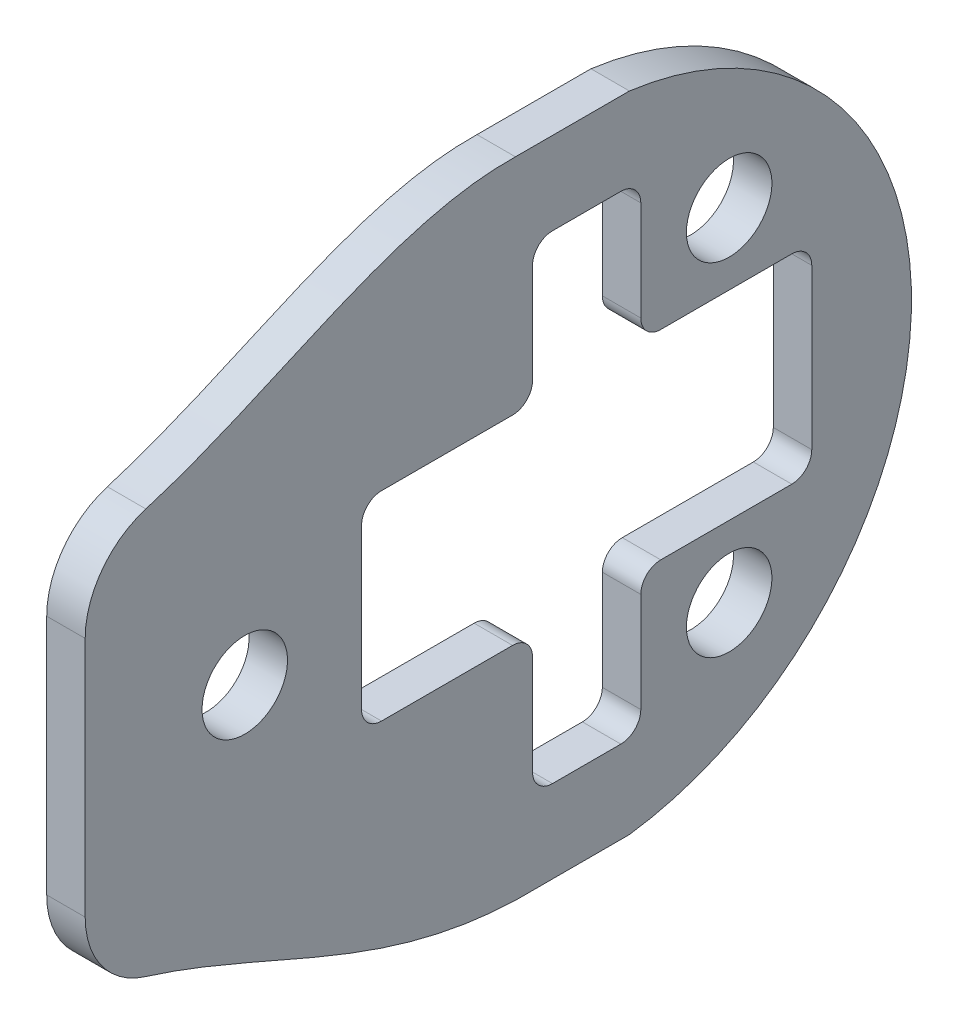
from build123d import *

# Parameters (mm, degrees)
SCHIZZO1_R                   = 1.5
ESTRUSIONE_ESTRUSIONE1_DEPTH = 1.35
RACCORDO2_R                  = 3
RACCORDO3_R                  = 3
RACCORDO4_R                  = 0.7


with BuildPart() as part:
    # Schizzo1 → Estrusione-Estrusione1 (new body)
    with BuildSketch(Plane(origin=(0, 0, 0), x_dir=(0, 0, -1), z_dir=(1, 0, 0))):
        with BuildLine():
            add(Edge.make_bspline(
                [(-7.501010101, -10.3), (-10.845030199, -9.13986581), (-13.865102381, -7.304364218), (-17.601010101, -6.594005849)],
                knots=[0.271280726, 0.271280726, 0.271280726, 0.271280726, 0.852483684, 0.852483684, 0.852483684, 0.852483684], degree=3))
            add(Edge.make_bspline(
                [(-2.501010101, -11.3), (-4.308742426, -11.235865063), (-5.940164296, -10.841501107), (-7.501010101, -10.3)],
                knots=[0, 0, 0, 0, 0.271280726, 0.271280726, 0.271280726, 0.271280726], degree=3))
            Line((-2.501010101, -11.3), (1.498989899, -11.3))
            ThreePointArc((1.498989899, -11.3), (11.398989899, 0), (1.498989899, 11.3))
            Line((1.498989899, 11.3), (-2.501010101, 11.3))
            add(Edge.make_bspline(
                [(-2.501010101, 11.3), (-4.209338931, 11.338090952), (-5.850739142, 10.914740779), (-7.501010101, 10.3)],
                knots=[0, 0, 0, 0, 0.293888871, 0.293888871, 0.293888871, 0.293888871], degree=3))
            add(Edge.make_bspline(
                [(-7.501010101, 10.3), (-10.658273676, 9.123890914), (-13.848006436, 7.247243694), (-17.601010101, 6.561146452)],
                knots=[0.293888871, 0.293888871, 0.293888871, 0.293888871, 0.856150858, 0.856150858, 0.856150858, 0.856150858], degree=3))
            Line((-17.601010101, 6.561146452), (-17.601010101, 0))
            Line((-17.601010101, 0), (-17.601010101, -6.594005849))
        make_face()
        with Locations(Location((5, -6, 0), (0, 0, 180))):
            Circle(SCHIZZO1_R, mode=Mode.SUBTRACT)
        with BuildLine():
            ThreePointArc((-10.5, 0), (-12, -1.5), (-13.5, 0))
            ThreePointArc((-13.5, 0), (-12, 1.5), (-10.5, 0))
        make_face(mode=Mode.SUBTRACT)
        Polygon((-7.9, -3.5), (-7.9, 0), (-7.9, 3.5), (-1.901010101, 3.5), (-1.901010101, 8.4), (1.898989899, 8.4), (1.898989899, 3.5), (7.898989899, 3.5), (7.898989899, -3.5), (1.898989899, -3.5), (1.898989899, -8.4), (-1.901010101, -8.4), (-1.901010101, -3.5), align=None, mode=Mode.SUBTRACT)
        with Locations(Location((5, 6, 0), (0, 0, 180))):
            Circle(SCHIZZO1_R, mode=Mode.SUBTRACT)
    extrude(amount=ESTRUSIONE_ESTRUSIONE1_DEPTH)

    # Raccordo2
    raccordo2_edges = [part.edges().sort_by_distance(p)[0] for p in [
        (0.675, -6.594005849, 17.601010101),
    ]]
    fillet(raccordo2_edges, radius=RACCORDO2_R)

    # Raccordo3
    raccordo3_edges = [part.edges().sort_by_distance(p)[0] for p in [
        (0.675, 6.561146452, 17.601010101),
    ]]
    fillet(raccordo3_edges, radius=RACCORDO3_R)

    # Raccordo4
    raccordo4_edges = [part.edges().sort_by_distance(p)[0] for p in [
        (0.675, -3.5, 1.901010101),
        (0.675, -8.4, 1.901010101),
        (0.675, -8.4, -1.898989899),
        (0.675, -3.5, -1.898989899),
        (0.675, -3.5, -7.898989899),
        (0.675, 3.5, -7.898989899),
        (0.675, 3.5, -1.898989899),
        (0.675, 8.4, -1.898989899),
        (0.675, 8.4, 1.901010101),
        (0.675, 3.5, 1.901010101),
        (0.675, 3.5, 7.9),
        (0.675, -3.5, 7.9),
    ]]
    fillet(raccordo4_edges, radius=RACCORDO4_R)


solid = part.part
